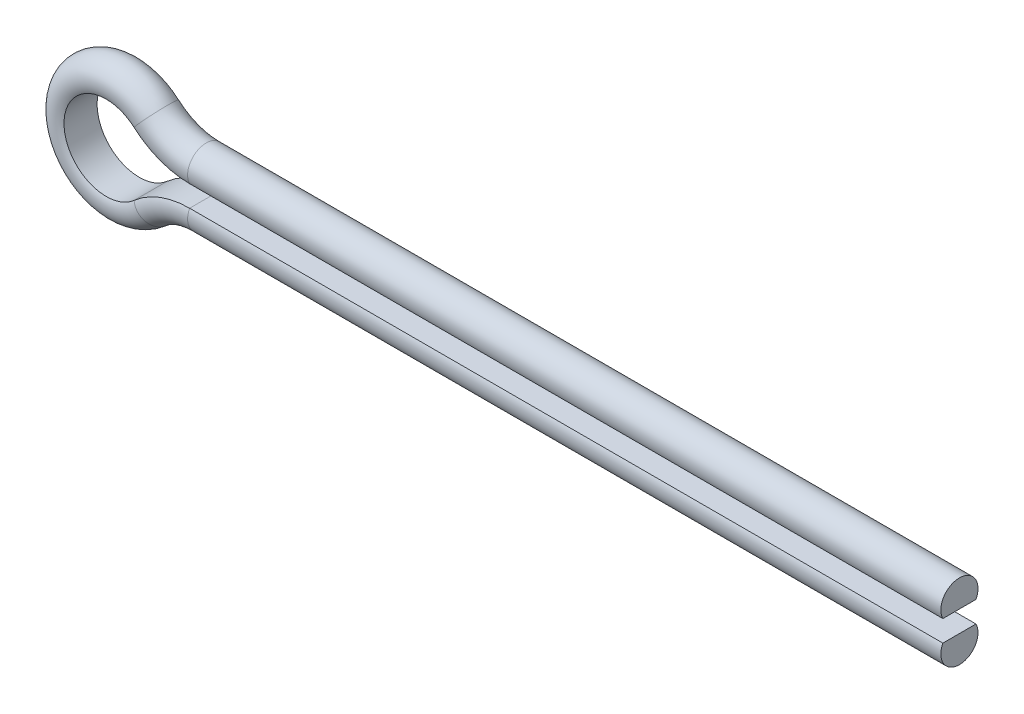
from build123d import *


with BuildPart() as part:
    # Sweep3: sweep along a path in Sketch1
    with BuildLine(Plane.XY) as sweep3_path:
        Line((956.940936911, -27.733721479), (61.474342577, -27.733721479))
        ThreePointArc((61.474342577, -27.733721479), (26.119003518, -34.19228681), (-4.669440199, -52.733721479))
        ThreePointArc((-4.669440199, -52.733721479), (-87.741331587, -15.233721479), (-4.669440199, 22.266278521))
        ThreePointArc((-4.669440199, 22.266278521), (26.119003518, 3.724843852), (61.474342577, -2.733721479))
        Line((61.474342577, -2.733721479), (956.940936911, -2.733721479))
    # Sketch2 → Sweep3 (sweep)
    with BuildSketch(Plane(origin=(956.940936911, -2.733721479, 0), x_dir=(0, 0, 1), z_dir=(-1, 0, 0))):
        with BuildLine():
            Line((19.697649121, 0.125995109), (-19.697649121, 0.125995109))
            ThreePointArc((-19.697649121, 0.125995109), (0, 32.216657863), (19.697649121, 0.125995109))
        make_face()
    sweep(path=sweep3_path.line)


solid = part.part
